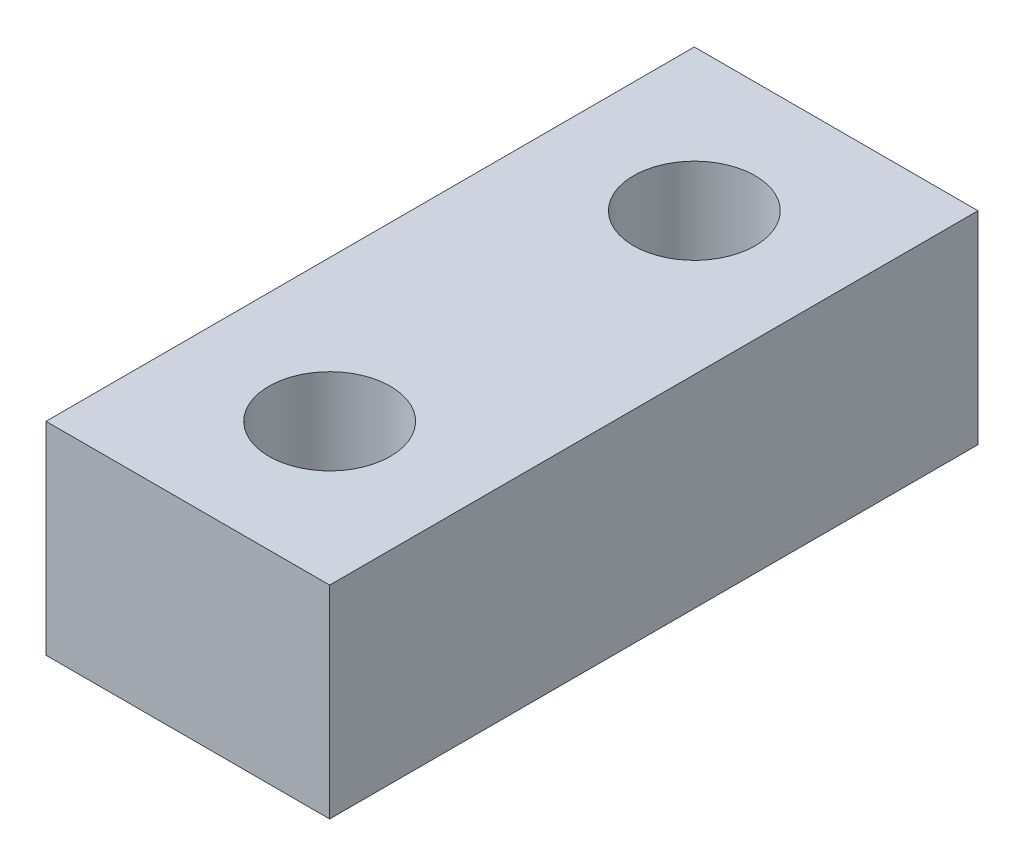
from build123d import *

# Parameters (mm, degrees)
SCHIZZO1_W                   = 7
SCHIZZO1_H                   = 5
ESTRUSIONE_ESTRUSIONE1_DEPTH = 16
SCHIZZO2_R                   = 1.5
TAGLIO_ESTRUSIONE1_DEPTH     = 19.165902125


with BuildPart() as part:
    # Schizzo1 → Estrusione-Estrusione1 (new body)
    with BuildSketch(Plane.XY):
        with Locations((-3.5, 2.5)):
            Rectangle(SCHIZZO1_W, SCHIZZO1_H)
    extrude(amount=ESTRUSIONE_ESTRUSIONE1_DEPTH)

    # Schizzo2 → Taglio-Estrusione1 (cut, through all)
    with BuildSketch(Plane(origin=(0, 0, 0), x_dir=(-1, 0, 0), z_dir=(0, -1, 0))):
        with Locations(Location((3.5, -12.5, 0), (0, 0, 180))):
            Circle(SCHIZZO2_R)
        with Locations(Location((3.5, -3.5, 0), (0, 0, 180))):
            Circle(SCHIZZO2_R)
    extrude(amount=-TAGLIO_ESTRUSIONE1_DEPTH, mode=Mode.SUBTRACT)


solid = part.part
